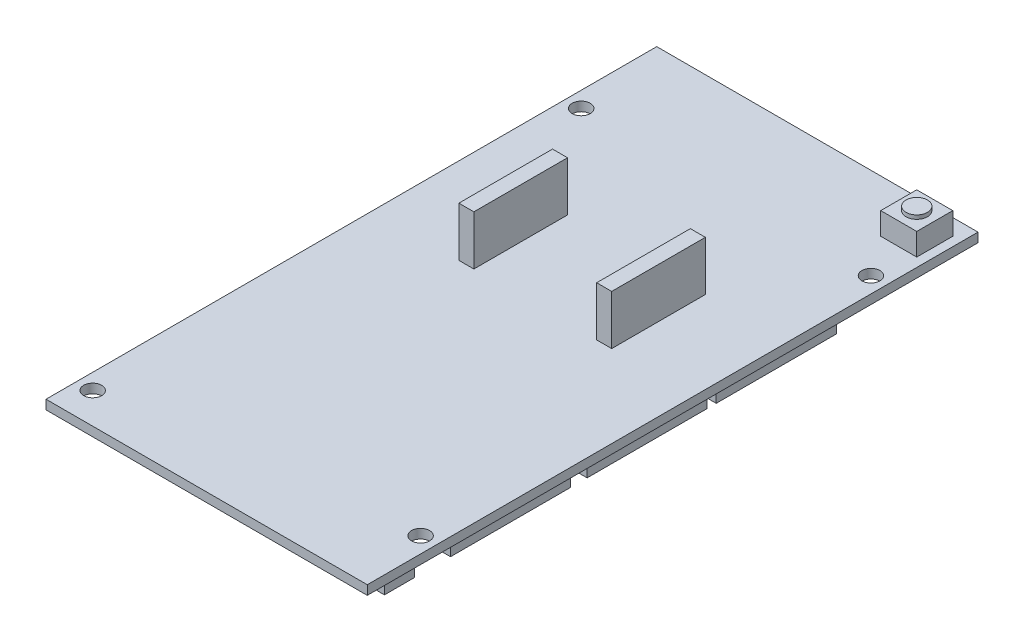
from build123d import *

# Parameters (mm, degrees)
SKETCH1_W           = 53.5
SKETCH1_H           = 101.7
SKETCH1_R           = 1.5
BOSS_EXTRUDE1_DEPTH = 1.54
SKETCH2_W           = 2.5
SKETCH2_H           = 15.6
BOSS_EXTRUDE2_DEPTH = 8.25
SKETCH3_W           = 6
SKETCH3_H           = 6
BOSS_EXTRUDE3_DEPTH = 3.7
SKETCH5_R           = 1.785
BOSS_EXTRUDE5_DEPTH = 0.64
SKETCH4_W           = 45.5
SKETCH4_H           = 5
SKETCH4_W_2         = 2.5
SKETCH4_H_2         = 20
SKETCH4_W_3         = 5
SKETCH4_H_3         = 14.9
BOSS_EXTRUDE4_DEPTH = 2.5


with BuildPart() as part:
    # Sketch1 → Boss-Extrude1 (new body)
    with BuildSketch(Plane(origin=(0, 0, 0), x_dir=(1, 0, 0), z_dir=(0, 1, 0))):
        Rectangle(SKETCH1_W, SKETCH1_H)
        with Locations(Location((24.125, -39.35, 0), (0, 0, 270))):
            Circle(SKETCH1_R, mode=Mode.SUBTRACT)
        with Locations(Location((-24.125, -45.7, 0), (0, 0, 270))):
            Circle(SKETCH1_R, mode=Mode.SUBTRACT)
        with Locations(Location((24.125, 35.65, 0), (0, 0, 270))):
            Circle(SKETCH1_R, mode=Mode.SUBTRACT)
        with Locations(Location((-24.125, 35.65, 0), (0, 0, 270))):
            Circle(SKETCH1_R, mode=Mode.SUBTRACT)
    extrude(amount=BOSS_EXTRUDE1_DEPTH)

    # Sketch2 → Boss-Extrude2 (add)
    with BuildSketch(Plane(origin=(0, 1.54, 0), x_dir=(1, 0, 0), z_dir=(0, 1, 0))):
        with Locations((11.8, 11.35)):
            Rectangle(SKETCH2_W, SKETCH2_H)
        with Locations((-11.15, 11.35)):
            Rectangle(SKETCH2_W, SKETCH2_H)
    extrude(amount=BOSS_EXTRUDE2_DEPTH)

    # Sketch3 → Boss-Extrude3 (add)
    with BuildSketch(Plane(origin=(0, 1.54, 0), x_dir=(1, 0, 0), z_dir=(0, 1, 0))):
        with Locations((22.25, 45.15)):
            Rectangle(SKETCH3_W, SKETCH3_H)
    extrude(amount=BOSS_EXTRUDE3_DEPTH)

    # Sketch5 → Boss-Extrude5 (add)
    with BuildSketch(Plane(origin=(0, 5.24, 0), x_dir=(1, 0, 0), z_dir=(0, 1, 0))):
        with Locations(Location((22.25, 45.15, 0), (0, 0, 90))):
            Circle(SKETCH5_R)
    extrude(amount=BOSS_EXTRUDE5_DEPTH)

    # Sketch4 → Boss-Extrude4 (add)
    with BuildSketch(Plane.XZ):
        with Locations((2.86, 44.35)):
            Rectangle(SKETCH4_W, SKETCH4_H)
        with Locations((24.36, 25.85)):
            Rectangle(SKETCH4_W_2, SKETCH4_H_2)
        with Locations((23.11, 3.1)):
            Rectangle(SKETCH4_W_3, SKETCH4_H_2)
        with Locations((23.11, -18.4)):
            Rectangle(SKETCH4_W_3, SKETCH4_H_2)
        with Locations((-23.9, 31.95)):
            Rectangle(SKETCH4_W_2, SKETCH4_H_2)
        with Locations((-23.9, 9.2)):
            Rectangle(SKETCH4_W_2, SKETCH4_H_2)
        with Locations((-23.9, -11)):
            Rectangle(SKETCH4_W_2, SKETCH4_H_3)
    extrude(amount=BOSS_EXTRUDE4_DEPTH)


solid = part.part
